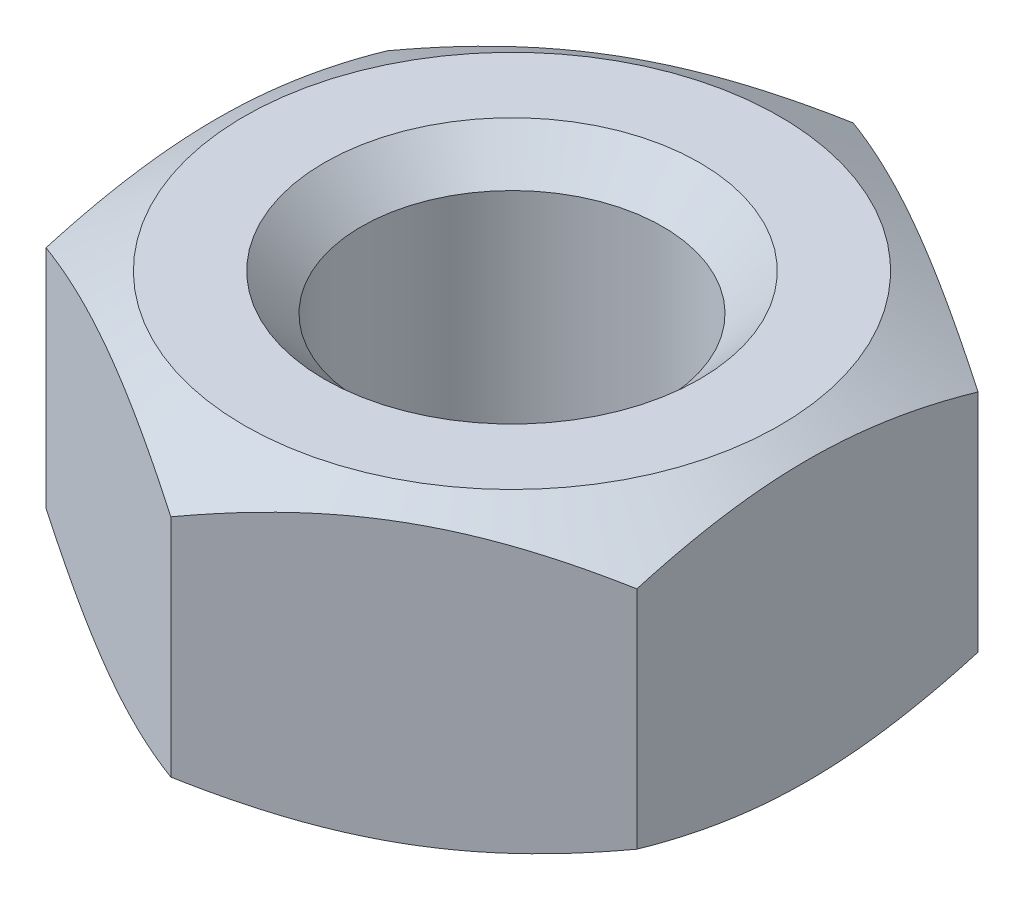
from build123d import *

# Parameters (mm, degrees)
EXTRUDE_1_DEPTH     = 8.4
M10X1_51_D          = 8.16
CHAMFER_1_SIZE      = 1
SKETCH_5_OUTSIDE_W  = 78.002
SKETCH_5_OUTSIDE_H  = 80.478
SKETCH_5_OUTSIDE_R  = 7.25
CUT_EXTRUDE_1_DEPTH = 15.828800806
CUT_EXTRUDE_1_DRAFT = -60
SKETCH_6_OUTSIDE_W  = 78.002
SKETCH_6_OUTSIDE_H  = 80.478
SKETCH_6_OUTSIDE_R  = 7.25
CUT_EXTRUDE_2_DEPTH = 15.828800806
CUT_EXTRUDE_2_DRAFT = -60


with BuildPart() as part:
    # Эскиз1 → Бобышка-Вытянуть1 (new body)
    with BuildSketch(Plane(origin=(0, 0, 0), x_dir=(1, 0, 0), z_dir=(0, 1, 0))):
        Polygon((0, 9.237604307), (-8, 4.618802154), (-8, -4.618802154), (0, -9.237604307), (8, -4.618802154), (8, 4.618802154), align=None)
    extrude(amount=EXTRUDE_1_DEPTH)

    # Отверстие обработанное метчиком M10x1.51 (through all)
    with Locations(Plane(origin=(0, 0, 0), x_dir=(-1, 0, 0), z_dir=(0, -1, 0))):
        with Locations((0, 0)):
            Hole(M10X1_51_D / 2)

    # Фаска1
    chamfer_1_edges = [part.edges().sort_by_distance(p)[0] for p in [
        (-4.08, 0, 0),
        (-4.08, 8.4, 0),
    ]]
    chamfer(chamfer_1_edges, length=CHAMFER_1_SIZE)


with BuildPart() as cut_extrude_1_tool:
    # Эскиз5 outside → Вырез-Вытянуть1 (with draft: the straight prism first)
    with BuildSketch(Plane.XZ):
        Rectangle(SKETCH_5_OUTSIDE_W, SKETCH_5_OUTSIDE_H)
        Circle(SKETCH_5_OUTSIDE_R, mode=Mode.SUBTRACT)
    extrude(amount=-CUT_EXTRUDE_1_DEPTH)
    # Вырез-Вытянуть1: the draft: its side faces are tilted about the plane it starts from
    cut_extrude_1_sides = [cut_extrude_1_tool.faces().sort_by_distance(p)[0] for p in [
        (0, 7.914400403, -40.239),
        (39.001, 7.914400403, 0),
        (0, 7.914400403, 40.239),
        (-39.001, 7.914400403, 0),
        (-7.25, 7.914400403, 0),
    ]]
    draft(cut_extrude_1_sides, Plane.XZ, CUT_EXTRUDE_1_DRAFT)


with BuildPart() as part_1:
    add(part.part)

    # Вырез-Вытянуть1: cut by cut_extrude_1_tool
    add(cut_extrude_1_tool.part, mode=Mode.SUBTRACT)


with BuildPart() as cut_extrude_2_tool:
    # Эскиз6 outside → Вырез-Вытянуть2 (with draft: the straight prism first)
    with BuildSketch(Plane(origin=(0, 8.4, 0), x_dir=(1, 0, 0), z_dir=(0, 1, 0))):
        Rectangle(SKETCH_6_OUTSIDE_W, SKETCH_6_OUTSIDE_H)
        Circle(SKETCH_6_OUTSIDE_R, mode=Mode.SUBTRACT)
    extrude(amount=-CUT_EXTRUDE_2_DEPTH)
    # Вырез-Вытянуть2: the draft: its side faces are tilted about the plane it starts from
    cut_extrude_2_sides = [cut_extrude_2_tool.faces().sort_by_distance(p)[0] for p in [
        (0, 0.485599597, 40.239),
        (39.001, 0.485599597, 0),
        (0, 0.485599597, -40.239),
        (-39.001, 0.485599597, 0),
        (-7.25, 0.485599597, 0),
    ]]
    draft(cut_extrude_2_sides, Plane(origin=(0, 8.4, 0), x_dir=(1, 0, 0), z_dir=(0, 1, 0)), CUT_EXTRUDE_2_DRAFT)


with BuildPart() as part_2:
    add(part_1.part)

    # Вырез-Вытянуть2: cut by cut_extrude_2_tool
    add(cut_extrude_2_tool.part, mode=Mode.SUBTRACT)


solid = part_2.part
